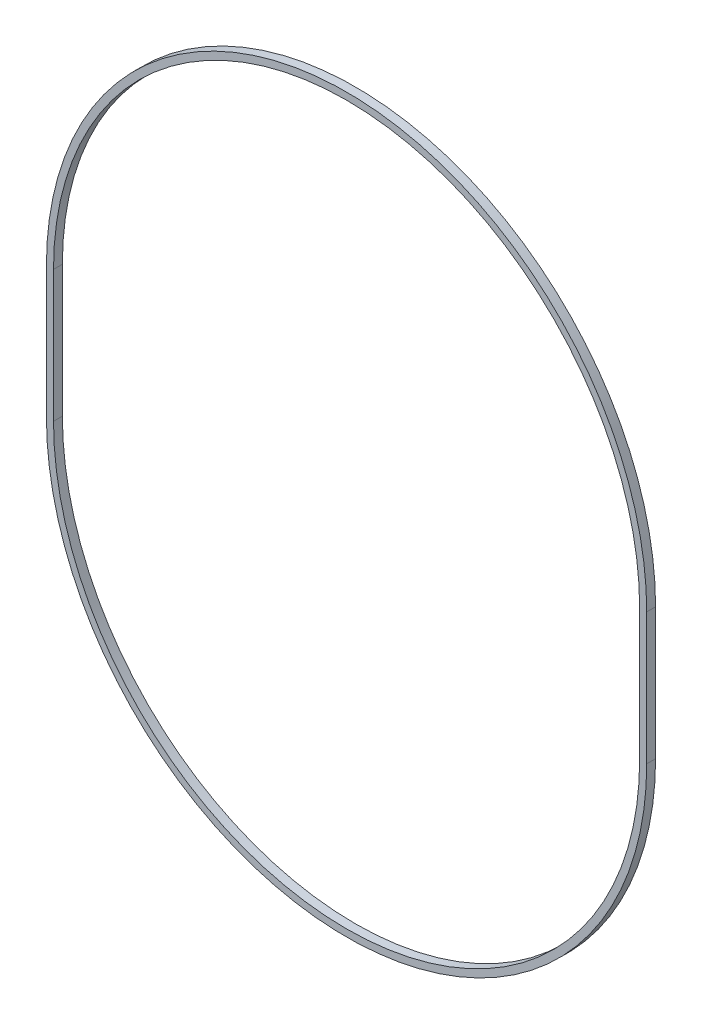
from build123d import *

# Parameters (mm, degrees)
BOSS_EXTRUDE1_DEPTH = 1.875


with BuildPart() as part:
    # Sketch1 → Boss-Extrude1 (new, symmetric)
    with BuildSketch(Plane.XY):
        with BuildLine():
            Line((-127.19, 27.875), (-127.19, -27.875))
            ThreePointArc((-127.19, -27.875), (0, -155.065), (127.19, -27.875))
            Line((127.19, -27.875), (127.19, 27.875))
            ThreePointArc((127.19, 27.875), (0, 155.065), (-127.19, 27.875))
        make_face()
        with BuildLine():
            ThreePointArc((-124.19, -27.875), (0, -152.065), (124.19, -27.875))
            Line((124.19, -27.875), (124.19, 27.875))
            ThreePointArc((124.19, 27.875), (0, 152.065), (-124.19, 27.875))
            Line((-124.19, 27.875), (-124.19, -27.875))
        make_face(mode=Mode.SUBTRACT)
    extrude(amount=BOSS_EXTRUDE1_DEPTH, both=True)


solid = part.part
